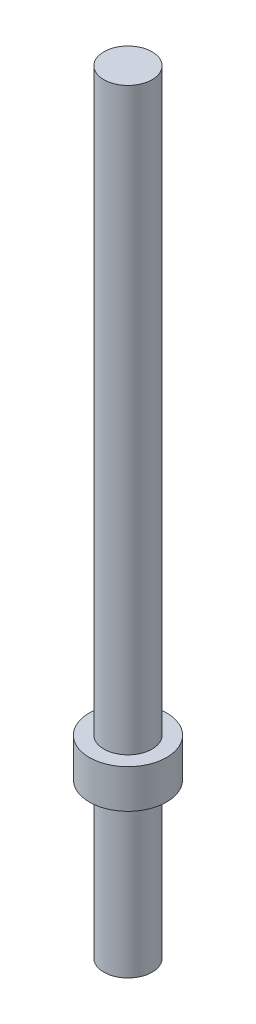
from build123d import *

# Parameters (mm, degrees)
SKETCH1_R           = 2.5
BOSS_EXTRUDE1_DEPTH = 60
SKETCH2_R           = 4
BOSS_EXTRUDE2_DEPTH = 4
BOSS_EXTRUDE3_START = -20
SKETCH3_R           = 2.5
BOSS_EXTRUDE3_DEPTH = 20


with BuildPart() as part:
    # Sketch1 → Boss-Extrude1 (new body)
    with BuildSketch(Plane(origin=(0, 0, 0), x_dir=(1, 0, 0), z_dir=(0, 1, 0))):
        with Locations(Location((0, 0, 0), (0, 0, 270))):
            Circle(SKETCH1_R)
    extrude(amount=BOSS_EXTRUDE1_DEPTH)

    # Sketch2 → Boss-Extrude2 (add)
    with BuildSketch(Plane(origin=(0, 0, 0), x_dir=(1, 0, 0), z_dir=(0, 1, 0))):
        with Locations(Location((0, 0, 0), (0, 0, 270))):
            Circle(SKETCH2_R)
    extrude(amount=-BOSS_EXTRUDE2_DEPTH)

    # Sketch3 → Boss-Extrude3 (add)
    with BuildSketch(Plane(origin=(0, 0, 0), x_dir=(1, 0, 0), z_dir=(0, 1, 0)).offset(BOSS_EXTRUDE3_START)):
        with Locations(Location((0, 0, 0), (0, 0, 270))):
            Circle(SKETCH3_R)
    extrude(amount=BOSS_EXTRUDE3_DEPTH)


solid = part.part
